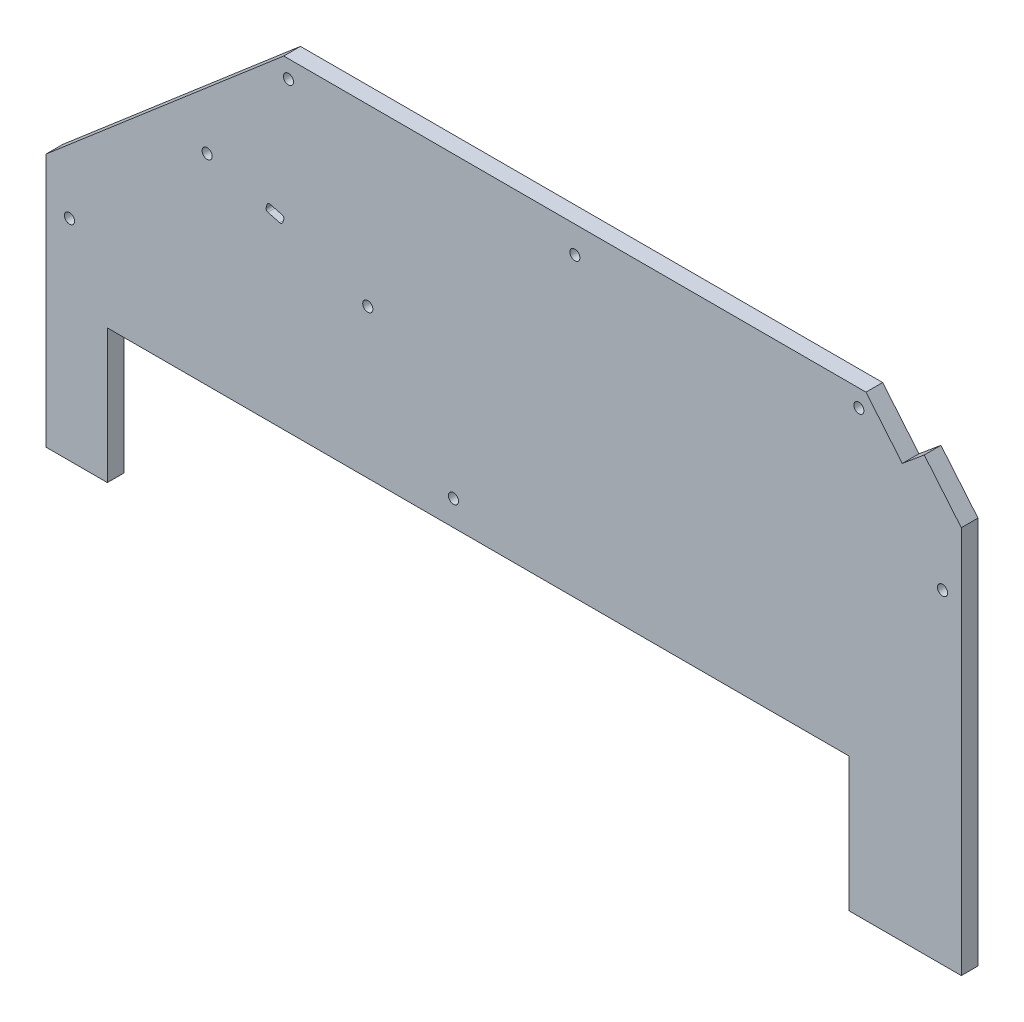
from build123d import *

# Parameters (mm, degrees)
SKETCH1_R               = 3.3782
BOSS_EXTRUDE1_DEPTH     = 11.1125
SKETCH2_R               = 3.3655
CUT_EXTRUDE1_DEPTH      = 422.26425461
SKETCH3_R               = 3.3655
CUT_EXTRUDE2_DEPTH      = 422.154164722
SKETCH4_R               = 3.3655
CUT_EXTRUDE3_DEPTH      = 422.154164722
SKETCH5_R               = 3.3655
CUT_EXTRUDE4_DEPTH      = 422.154164722
CUT_EXTRUDE5_DEPTH      = 422.369531068
CUT_EXTRUDE5_DEPTH_BACK = 422.369531068
SKETCH6_R               = 3.3782
SKETCH7_W               = 19.45
SKETCH7_H               = 169.071428571
CUT_EXTRUDE6_DEPTH      = 694.733868394
BOSS_EXTRUDE2_DEPTH     = 11.1125


with BuildPart() as part:
    # Sketch1 → Boss-Extrude1 (new body)
    with BuildSketch(Plane.XY):
        Polygon((-629.05, -12.5), (-568.725, -12.5), (-568.725, 76.762), (-74.813700004, 76.762), (-74.813700004, -12.5), (0, -12.5), (0, 216.1), (-63.5, 292.3), (-451.25, 292.3), (-629.05, 139.9), align=None)
        with Locations((-12.5, 203.6)):
            Circle(SKETCH1_R, mode=Mode.SUBTRACT)
        with BuildLine():
            Line((-460.428573591, 202.287851535), (-452.336342065, 200.199533722))
            ThreePointArc((-452.336342065, 200.199533722), (-451.339589022, 199.42298326), (-451.225592299, 198.164590635))
            Line((-451.225592299, 198.164590635), (-451.993143659, 195.840315389))
            ThreePointArc((-451.993143659, 195.840315389), (-452.739984992, 194.944683826), (-453.897256136, 194.800977973))
            Line((-453.897256136, 194.800977973), (-461.832222689, 196.848711278))
            ThreePointArc((-461.832222689, 196.848711278), (-462.802959706, 197.57942531), (-462.972681585, 198.782532884))
            Line((-462.972681585, 198.782532884), (-462.362395197, 201.147392639))
            ThreePointArc((-462.362395197, 201.147392639), (-461.631681165, 202.118129655), (-460.428573591, 202.287851535))
        make_face(mode=Mode.SUBTRACT)
    extrude(amount=BOSS_EXTRUDE1_DEPTH)

    # Sketch2 → Cut-Extrude1 (cut, through all)
    with BuildSketch(Plane(origin=(-305, 23.6125, -5.08), x_dir=(-1, 0, 0), z_dir=(0, 0, -1))):
        with Locations((288.9533823, 103.7145)):
            Circle(SKETCH2_R)
    extrude(amount=-CUT_EXTRUDE1_DEPTH, mode=Mode.SUBTRACT)

    # Sketch3 → Cut-Extrude2 (cut, through all)
    with BuildSketch(Plane(origin=(-305, 23.6125, -1.905), x_dir=(-1, 0, 0), z_dir=(0, 0, -1))):
        with Locations((143.116254523, 256.904809604)):
            Circle(SKETCH3_R)
    extrude(amount=-CUT_EXTRUDE2_DEPTH, mode=Mode.SUBTRACT)

    # Sketch4 → Cut-Extrude3 (cut, through all)
    with BuildSketch(Plane(origin=(-305, 23.6125, -1.905), x_dir=(-1, 0, 0), z_dir=(0, 0, -1))):
        with Locations((-47.625, 250.9075)):
            Circle(SKETCH4_R)
    extrude(amount=-CUT_EXTRUDE3_DEPTH, mode=Mode.SUBTRACT)

    # Sketch5 → Cut-Extrude4 (cut, through all)
    with BuildSketch(Plane(origin=(-305, 23.6125, -1.905), x_dir=(-1, 0, 0), z_dir=(0, 0, -1))):
        with Locations((-236.766660116, 257.207608298)):
            Circle(SKETCH5_R)
    extrude(amount=-CUT_EXTRUDE4_DEPTH, mode=Mode.SUBTRACT)

    # Sketch6 → Cut-Extrude5 (cut, two sides: drawn at the far end of the back side and taken through both)
    with BuildSketch(Plane(origin=(-305, 23.6125, 18.7325), x_dir=(1, 0, 0), z_dir=(0, 0, 1)).offset(-CUT_EXTRUDE5_DEPTH_BACK)):
        with Locations((-197.262125611, 186.926969688)):
            Circle(SKETCH6_R)
        with Locations((-33.209654284, 70.005387803)):
            Circle(SKETCH6_R)
        with Locations((-90.296950895, 152.235012548)):
            Circle(SKETCH6_R)
    extrude(amount=CUT_EXTRUDE5_DEPTH + CUT_EXTRUDE5_DEPTH_BACK, mode=Mode.SUBTRACT)

    # Sketch7 → Cut-Extrude6 (cut, through all)
    with BuildSketch(Plane.XY.offset(11.1125)):
        with Locations((-619.325, 72.035714286)):
            Rectangle(SKETCH7_W, SKETCH7_H)
    extrude(amount=-CUT_EXTRUDE6_DEPTH, mode=Mode.SUBTRACT)

    # Sketch9 → Boss-Extrude2 (add)
    with BuildSketch(Plane.XY.offset(11.1125)):
        Polygon((0, 216.1), (0, 245.857051265), (-24.6799078, 275.472940625), (-39.314523176, 263.277427812), align=None)
    extrude(amount=-BOSS_EXTRUDE2_DEPTH)


solid = part.part
